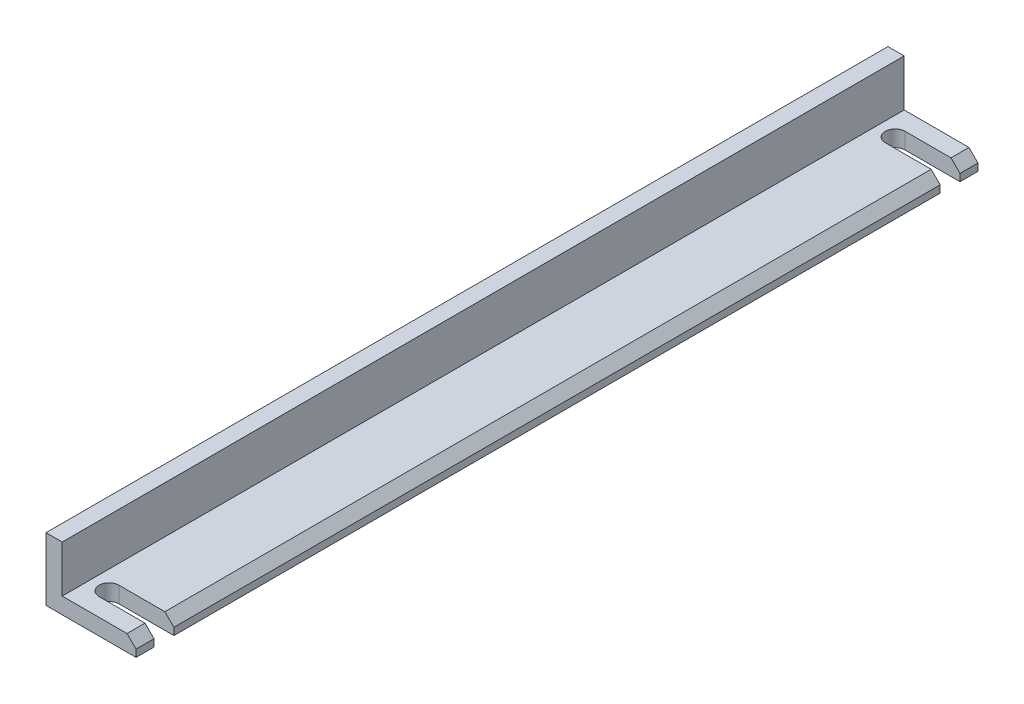
from build123d import *

# Parameters (mm, degrees)
EXTRUDE_THIN1_DEPTH = 46.75
CHAMFER1_SIZE       = 1
CUT_EXTRUDE1_DEPTH  = 10


with BuildPart() as part:
    # Sketch1 → Extrude-Thin1 (new, symmetric)
    with BuildSketch(Plane.XY):
        Polygon((10, 0), (0, 0), (0, 7), (1.8, 7), (1.8, 1.8), (10, 1.8), align=None)
    extrude(amount=EXTRUDE_THIN1_DEPTH, both=True)

    # Chamfer1
    chamfer1_edges = [part.edges().sort_by_distance(p)[0] for p in [
        (10, 1.8, 0),
    ]]
    chamfer(chamfer1_edges, length=CHAMFER1_SIZE)

    # Sketch2 → Cut-Extrude1 (cut)
    with BuildSketch(Plane(origin=(0, 1.8, 0), x_dir=(1, 0, 0), z_dir=(0, 1, 0))):
        with BuildLine():
            Line((11.522549571, -44.75), (3.9, -44.75))
            ThreePointArc((3.9, -44.75), (2.8, -43.65), (3.9, -42.55))
            Line((3.9, -42.55), (11.522549571, -42.55))
            ThreePointArc((11.522549571, -42.55), (12.622549571, -43.65), (11.522549571, -44.75))
        make_face()
    cut_extrude1 = extrude(amount=-CUT_EXTRUDE1_DEPTH, mode=Mode.SUBTRACT)

    # Mirror1: Cut-Extrude1 across plane
    add(cut_extrude1.mirror(Plane.XY), mode=Mode.SUBTRACT)


solid = part.part
